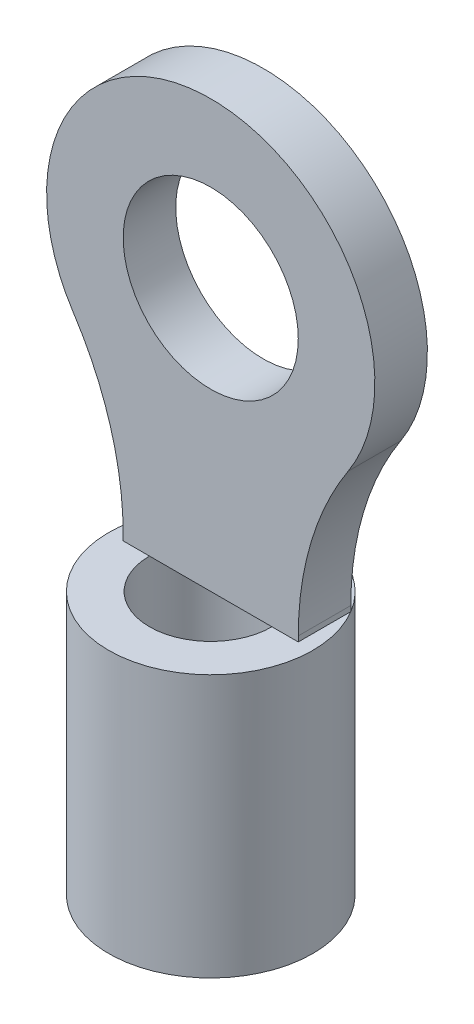
from build123d import *

# Parameters (mm, degrees)
SKETCH_1_R      = 0.5
EXTRUDE_1_DEPTH = 0.3
SKETCH_16_R     = 0.583095189
SKETCH_16_R_2   = 0.35
EXTRUDE_5_DEPTH = 1.5


with BuildPart() as part:
    # ｽｹｯﾁ1 → ﾎﾞｽ - 押し出し1 (new body)
    with BuildSketch(Plane.XY):
        with BuildLine():
            Line((-0.5, -1.5), (0.5, -1.5))
            Line((0.5, -1.5), (0.5, -1.469747002))
            ThreePointArc((0.5, -1.469747002), (0.572732358, -0.970474275), (0.784883721, -0.512702443))
            ThreePointArc((0.784883721, -0.512702443), (0, 0.9375), (-0.784883721, -0.512702443))
            ThreePointArc((-0.784883721, -0.512702443), (-0.572732358, -0.970474275), (-0.5, -1.469747002))
            Line((-0.5, -1.469747002), (-0.5, -1.5))
        make_face()
        Circle(SKETCH_1_R, mode=Mode.SUBTRACT)
    extrude(amount=EXTRUDE_1_DEPTH)

    # ｽｹｯﾁ16 → ﾎﾞｽ - 押し出し5 (add)
    with BuildSketch(Plane(origin=(0, -1.5, 0), x_dir=(-1, 0, 0), z_dir=(0, -1, 0))):
        with Locations(Location((0, -0.3, 0), (0, 0, 30.963756532))):
            Circle(SKETCH_16_R)
        with Locations(Location((0, -0.3, 0), (0, 0, 180))):
            Circle(SKETCH_16_R_2, mode=Mode.SUBTRACT)
    extrude(amount=EXTRUDE_5_DEPTH)


solid = part.part
